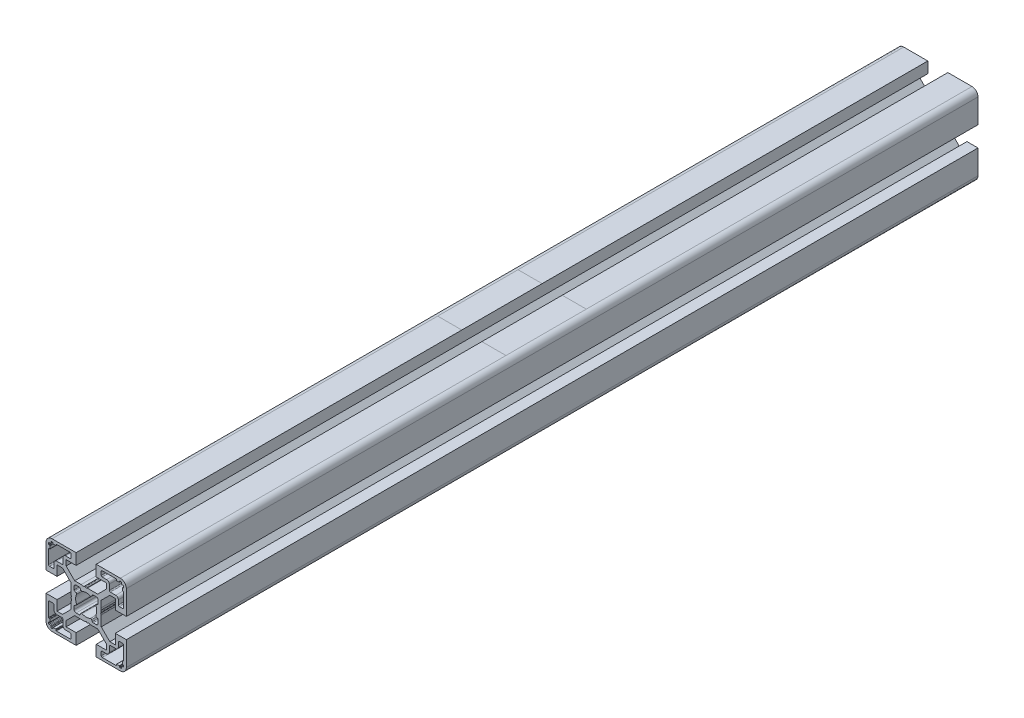
from build123d import *

# Parameters (mm, degrees)
BOSS_EXTRU_1_DEPTH = 424


with BuildPart() as part:
    # Esquisse1 → Boss.-Extru.1 (new body)
    with BuildSketch(Plane.XY.offset(50)):
        with BuildLine():
            Line((-12.564461466, 27.123082583), (-12.564461466, 15.123082583))
            Line((-12.564461466, 15.123082583), (-7.064461466, 15.123082583))
            Line((-7.064461466, 15.123082583), (-7.064461466, 20.123082583))
            Line((-7.064461466, 20.123082583), (-4.332228419, 20.123082583))
            Line((-4.332228419, 20.123082583), (-0.064461466, 15.85531563))
            Line((-0.064461466, 15.85531563), (-0.064461466, 10.776672421))
            ThreePointArc((-0.064461466, 10.776672421), (-0.047424379, 10.647262899), (0.002525832, 10.526672421))
            Line((0.002525832, 10.526672421), (0.235538534, 10.123082583))
            Line((0.235538534, 10.123082583), (0.002525832, 9.719492744))
            ThreePointArc((0.002525832, 9.719492744), (-0.064461466, 9.469492744), (0.002525832, 9.219492744))
            Line((0.002525832, 9.219492744), (0.184561942, 8.904196954))
            Line((0.184561942, 8.904196954), (-0.064461466, 7.623082583))
            Line((-0.064461466, 7.623082583), (-0.064461466, 4.390849536))
            Line((-0.064461466, 4.390849536), (-4.332228419, 0.123082583))
            Line((-4.332228419, 0.123082583), (-7.064461466, 0.123082583))
            Line((-7.064461466, 0.123082583), (-7.064461466, 5.123082583))
            Line((-7.064461466, 5.123082583), (-12.564461466, 5.123082583))
            Line((-12.564461466, 5.123082583), (-12.564461466, -6.876917417))
            ThreePointArc((-12.564461466, -6.876917417), (-11.685781809, -8.998237761), (-9.564461466, -9.876917417))
            Line((-9.564461466, -9.876917417), (2.435538534, -9.876917417))
            Line((2.435538534, -9.876917417), (2.435538534, -4.376917417))
            Line((2.435538534, -4.376917417), (-2.564461466, -4.376917417))
            Line((-2.564461466, -4.376917417), (-2.564461466, -1.64468437))
            Line((-2.564461466, -1.64468437), (1.703305487, 2.623082583))
            Line((1.703305487, 2.623082583), (6.781948696, 2.623082583))
            ThreePointArc((6.781948696, 2.623082583), (6.911358218, 2.640119669), (7.031948696, 2.690069881))
            Line((7.031948696, 2.690069881), (7.435538534, 2.923082583))
            Line((7.435538534, 2.923082583), (7.839128373, 2.690069881))
            ThreePointArc((7.839128373, 2.690069881), (8.089128373, 2.623082583), (8.339128373, 2.690069881))
            Line((8.339128373, 2.690069881), (8.654424163, 2.87210599))
            Line((8.654424163, 2.87210599), (9.935538534, 2.623082583))
            Line((9.935538534, 2.623082583), (13.167771581, 2.623082583))
            Line((13.167771581, 2.623082583), (17.435538534, -1.64468437))
            Line((17.435538534, -1.64468437), (17.435538534, -4.376917417))
            Line((17.435538534, -4.376917417), (12.435538534, -4.376917417))
            Line((12.435538534, -4.376917417), (12.435538534, -9.876917417))
            Line((12.435538534, -9.876917417), (24.435538534, -9.876917417))
            ThreePointArc((24.435538534, -9.876917417), (26.556858878, -8.998237761), (27.435538534, -6.876917417))
            Line((27.435538534, -6.876917417), (27.435538534, 5.123082583))
            Line((27.435538534, 5.123082583), (21.935538534, 5.123082583))
            Line((21.935538534, 5.123082583), (21.935538534, 0.123082583))
            Line((21.935538534, 0.123082583), (19.203305487, 0.123082583))
            Line((19.203305487, 0.123082583), (14.935538534, 4.390849536))
            Line((14.935538534, 4.390849536), (14.935538534, 9.469492744))
            ThreePointArc((14.935538534, 9.469492744), (14.918501447, 9.598902267), (14.868551236, 9.719492744))
            Line((14.868551236, 9.719492744), (14.635538534, 10.123082583))
            Line((14.635538534, 10.123082583), (14.868551236, 10.526672421))
            ThreePointArc((14.868551236, 10.526672421), (14.935538534, 10.776672421), (14.868551236, 11.026672421))
            Line((14.868551236, 11.026672421), (14.686515127, 11.341968211))
            Line((14.686515127, 11.341968211), (14.935538534, 12.623082583))
            Line((14.935538534, 12.623082583), (14.935538534, 15.85531563))
            Line((14.935538534, 15.85531563), (19.203305487, 20.123082583))
            Line((19.203305487, 20.123082583), (21.935538534, 20.123082583))
            Line((21.935538534, 20.123082583), (21.935538534, 15.123082583))
            Line((21.935538534, 15.123082583), (27.435538534, 15.123082583))
            Line((27.435538534, 15.123082583), (27.435538534, 27.123082583))
            ThreePointArc((27.435538534, 27.123082583), (26.556858878, 29.244402926), (24.435538534, 30.123082583))
            Line((24.435538534, 30.123082583), (12.435538534, 30.123082583))
            Line((12.435538534, 30.123082583), (12.435538534, 24.623082583))
            Line((12.435538534, 24.623082583), (17.435538534, 24.623082583))
            Line((17.435538534, 24.623082583), (17.435538534, 21.890849536))
            Line((17.435538534, 21.890849536), (13.167771581, 17.623082583))
            Line((13.167771581, 17.623082583), (8.089128373, 17.623082583))
            ThreePointArc((8.089128373, 17.623082583), (7.95971885, 17.606045496), (7.839128373, 17.556095285))
            Line((7.839128373, 17.556095285), (7.435538534, 17.323082583))
            Line((7.435538534, 17.323082583), (7.031948696, 17.556095285))
            ThreePointArc((7.031948696, 17.556095285), (6.781948696, 17.623082583), (6.531948696, 17.556095285))
            Line((6.531948696, 17.556095285), (6.216652905, 17.374059175))
            Line((6.216652905, 17.374059175), (4.935538534, 17.623082583))
            Line((4.935538534, 17.623082583), (1.703305487, 17.623082583))
            Line((1.703305487, 17.623082583), (-2.564461466, 21.890849536))
            Line((-2.564461466, 21.890849536), (-2.564461466, 24.623082583))
            Line((-2.564461466, 24.623082583), (2.435538534, 24.623082583))
            Line((2.435538534, 24.623082583), (2.435538534, 30.123082583))
            Line((2.435538534, 30.123082583), (-9.564461466, 30.123082583))
            ThreePointArc((-9.564461466, 30.123082583), (-11.685781809, 29.244402926), (-12.564461466, 27.123082583))
        make_face()
        with BuildLine():
            Line((-11.264461466, -4.676917417), (-11.264461466, 2.123082583))
            ThreePointArc((-11.264461466, 2.123082583), (-11.118014856, 2.476635973), (-10.764461466, 2.623082583))
            Line((-10.764461466, 2.623082583), (-9.064461466, 2.623082583))
            ThreePointArc((-9.064461466, 2.623082583), (-8.710908075, 2.476635973), (-8.564461466, 2.123082583))
            Line((-8.564461466, 2.123082583), (-8.564461466, -0.076917417))
            ThreePointArc((-8.564461466, -0.076917417), (-8.183700281, -0.996156233), (-7.264461466, -1.376917417))
            Line((-7.264461466, -1.376917417), (-4.564461466, -1.376917417))
            ThreePointArc((-4.564461466, -1.376917417), (-4.210908075, -1.523364027), (-4.064461466, -1.876917417))
            Line((-4.064461466, -1.876917417), (-4.064461466, -4.576917417))
            ThreePointArc((-4.064461466, -4.576917417), (-3.683700281, -5.496156233), (-2.764461466, -5.876917417))
            Line((-2.764461466, -5.876917417), (-0.564461466, -5.876917417))
            ThreePointArc((-0.564461466, -5.876917417), (-0.210908075, -6.023364027), (-0.064461466, -6.376917417))
            Line((-0.064461466, -6.376917417), (-0.064461466, -8.076917417))
            ThreePointArc((-0.064461466, -8.076917417), (-0.210908075, -8.430470808), (-0.564461466, -8.576917417))
            Line((-0.564461466, -8.576917417), (-7.364461466, -8.576917417))
            ThreePointArc((-7.364461466, -8.576917417), (-7.505882822, -8.518338774), (-7.564461466, -8.376917417))
            Line((-7.564461466, -8.376917417), (-7.564461466, -8.076917417))
            ThreePointArc((-7.564461466, -8.076917417), (-7.62304011, -7.935496061), (-7.764461466, -7.876917417))
            Line((-7.764461466, -7.876917417), (-8.964461466, -7.876917417))
            ThreePointArc((-8.964461466, -7.876917417), (-9.105882822, -7.935496061), (-9.164461466, -8.076917417))
            Line((-9.164461466, -8.076917417), (-9.164461466, -8.376917417))
            ThreePointArc((-9.164461466, -8.376917417), (-9.22304011, -8.518338774), (-9.364461466, -8.576917417))
            Line((-9.364461466, -8.576917417), (-9.864461466, -8.576917417))
            ThreePointArc((-9.864461466, -8.576917417), (-10.0765935, -8.489049452), (-10.164461466, -8.276917417))
            Line((-10.164461466, -8.276917417), (-10.164461466, -7.776917417))
            ThreePointArc((-10.164461466, -7.776917417), (-10.252329431, -7.564785383), (-10.464461466, -7.476917417))
            Line((-10.464461466, -7.476917417), (-10.964461466, -7.476917417))
            ThreePointArc((-10.964461466, -7.476917417), (-11.1765935, -7.389049452), (-11.264461466, -7.176917417))
            Line((-11.264461466, -7.176917417), (-11.264461466, -6.676917417))
            ThreePointArc((-11.264461466, -6.676917417), (-11.205882822, -6.535496061), (-11.064461466, -6.476917417))
            Line((-11.064461466, -6.476917417), (-10.764461466, -6.476917417))
            ThreePointArc((-10.764461466, -6.476917417), (-10.62304011, -6.418338774), (-10.564461466, -6.276917417))
            Line((-10.564461466, -6.276917417), (-10.564461466, -5.076917417))
            ThreePointArc((-10.564461466, -5.076917417), (-10.62304011, -4.935496061), (-10.764461466, -4.876917417))
            Line((-10.764461466, -4.876917417), (-11.064461466, -4.876917417))
            ThreePointArc((-11.064461466, -4.876917417), (-11.205882822, -4.818338774), (-11.264461466, -4.676917417))
        make_face(mode=Mode.SUBTRACT)
        with BuildLine():
            Line((14.935538534, -8.076917417), (14.935538534, -6.376917417))
            ThreePointArc((14.935538534, -6.376917417), (15.081985144, -6.023364027), (15.435538534, -5.876917417))
            Line((15.435538534, -5.876917417), (17.635538534, -5.876917417))
            ThreePointArc((17.635538534, -5.876917417), (18.55477735, -5.496156233), (18.935538534, -4.576917417))
            Line((18.935538534, -4.576917417), (18.935538534, -1.876917417))
            ThreePointArc((18.935538534, -1.876917417), (19.081985144, -1.523364027), (19.435538534, -1.376917417))
            Line((19.435538534, -1.376917417), (22.135538534, -1.376917417))
            ThreePointArc((22.135538534, -1.376917417), (23.05477735, -0.996156233), (23.435538534, -0.076917417))
            Line((23.435538534, -0.076917417), (23.435538534, 2.123082583))
            ThreePointArc((23.435538534, 2.123082583), (23.581985144, 2.476635973), (23.935538534, 2.623082583))
            Line((23.935538534, 2.623082583), (25.635538534, 2.623082583))
            ThreePointArc((25.635538534, 2.623082583), (25.989091925, 2.476635973), (26.135538534, 2.123082583))
            Line((26.135538534, 2.123082583), (26.135538534, -4.676917417))
            ThreePointArc((26.135538534, -4.676917417), (26.07695989, -4.818338774), (25.935538534, -4.876917417))
            Line((25.935538534, -4.876917417), (25.635538534, -4.876917417))
            ThreePointArc((25.635538534, -4.876917417), (25.494117178, -4.935496061), (25.435538534, -5.076917417))
            Line((25.435538534, -5.076917417), (25.435538534, -6.276917417))
            ThreePointArc((25.435538534, -6.276917417), (25.494117178, -6.418338774), (25.635538534, -6.476917417))
            Line((25.635538534, -6.476917417), (25.935538534, -6.476917417))
            ThreePointArc((25.935538534, -6.476917417), (26.07695989, -6.535496061), (26.135538534, -6.676917417))
            Line((26.135538534, -6.676917417), (26.135538534, -7.176917417))
            ThreePointArc((26.135538534, -7.176917417), (26.047670569, -7.389049452), (25.835538534, -7.476917417))
            Line((25.835538534, -7.476917417), (25.335538534, -7.476917417))
            ThreePointArc((25.335538534, -7.476917417), (25.1234065, -7.564785383), (25.035538534, -7.776917417))
            Line((25.035538534, -7.776917417), (25.035538534, -8.276917417))
            ThreePointArc((25.035538534, -8.276917417), (24.947670569, -8.489049452), (24.735538534, -8.576917417))
            Line((24.735538534, -8.576917417), (24.235538534, -8.576917417))
            ThreePointArc((24.235538534, -8.576917417), (24.094117178, -8.518338774), (24.035538534, -8.376917417))
            Line((24.035538534, -8.376917417), (24.035538534, -8.076917417))
            ThreePointArc((24.035538534, -8.076917417), (23.97695989, -7.935496061), (23.835538534, -7.876917417))
            Line((23.835538534, -7.876917417), (22.635538534, -7.876917417))
            ThreePointArc((22.635538534, -7.876917417), (22.494117178, -7.935496061), (22.435538534, -8.076917417))
            Line((22.435538534, -8.076917417), (22.435538534, -8.376917417))
            ThreePointArc((22.435538534, -8.376917417), (22.37695989, -8.518338774), (22.235538534, -8.576917417))
            Line((22.235538534, -8.576917417), (15.435538534, -8.576917417))
            ThreePointArc((15.435538534, -8.576917417), (15.081985144, -8.430470808), (14.935538534, -8.076917417))
        make_face(mode=Mode.SUBTRACT)
        with BuildLine():
            Line((14.935538534, 26.623082583), (14.935538534, 28.323082583))
            ThreePointArc((14.935538534, 28.323082583), (15.081985144, 28.676635973), (15.435538534, 28.823082583))
            Line((15.435538534, 28.823082583), (22.235538534, 28.823082583))
            ThreePointArc((22.235538534, 28.823082583), (22.37695989, 28.764503939), (22.435538534, 28.623082583))
            Line((22.435538534, 28.623082583), (22.435538534, 28.323082583))
            ThreePointArc((22.435538534, 28.323082583), (22.494117178, 28.181661226), (22.635538534, 28.123082583))
            Line((22.635538534, 28.123082583), (23.835538534, 28.123082583))
            ThreePointArc((23.835538534, 28.123082583), (23.97695989, 28.181661226), (24.035538534, 28.323082583))
            Line((24.035538534, 28.323082583), (24.035538534, 28.623082583))
            ThreePointArc((24.035538534, 28.623082583), (24.094117178, 28.764503939), (24.235538534, 28.823082583))
            Line((24.235538534, 28.823082583), (24.735538534, 28.823082583))
            ThreePointArc((24.735538534, 28.823082583), (24.947670569, 28.735214617), (25.035538534, 28.523082583))
            Line((25.035538534, 28.523082583), (25.035538534, 28.023082583))
            ThreePointArc((25.035538534, 28.023082583), (25.1234065, 27.810950548), (25.335538534, 27.723082583))
            Line((25.335538534, 27.723082583), (25.835538534, 27.723082583))
            ThreePointArc((25.835538534, 27.723082583), (26.047670569, 27.635214617), (26.135538534, 27.423082583))
            Line((26.135538534, 27.423082583), (26.135538534, 26.923082583))
            ThreePointArc((26.135538534, 26.923082583), (26.07695989, 26.781661226), (25.935538534, 26.723082583))
            Line((25.935538534, 26.723082583), (25.635538534, 26.723082583))
            ThreePointArc((25.635538534, 26.723082583), (25.494117178, 26.664503939), (25.435538534, 26.523082583))
            Line((25.435538534, 26.523082583), (25.435538534, 25.323082583))
            ThreePointArc((25.435538534, 25.323082583), (25.494117178, 25.181661226), (25.635538534, 25.123082583))
            Line((25.635538534, 25.123082583), (25.935538534, 25.123082583))
            ThreePointArc((25.935538534, 25.123082583), (26.07695989, 25.064503939), (26.135538534, 24.923082583))
            Line((26.135538534, 24.923082583), (26.135538534, 18.123082583))
            ThreePointArc((26.135538534, 18.123082583), (25.989091925, 17.769529192), (25.635538534, 17.623082583))
            Line((25.635538534, 17.623082583), (23.935538534, 17.623082583))
            ThreePointArc((23.935538534, 17.623082583), (23.581985144, 17.769529192), (23.435538534, 18.123082583))
            Line((23.435538534, 18.123082583), (23.435538534, 20.323082583))
            ThreePointArc((23.435538534, 20.323082583), (23.05477735, 21.242321398), (22.135538534, 21.623082583))
            Line((22.135538534, 21.623082583), (19.435538534, 21.623082583))
            ThreePointArc((19.435538534, 21.623082583), (19.081985144, 21.769529192), (18.935538534, 22.123082583))
            Line((18.935538534, 22.123082583), (18.935538534, 24.823082583))
            ThreePointArc((18.935538534, 24.823082583), (18.55477735, 25.742321398), (17.635538534, 26.123082583))
            Line((17.635538534, 26.123082583), (15.435538534, 26.123082583))
            ThreePointArc((15.435538534, 26.123082583), (15.081985144, 26.269529192), (14.935538534, 26.623082583))
        make_face(mode=Mode.SUBTRACT)
        with BuildLine():
            Line((-11.264461466, 18.123082583), (-11.264461466, 24.923082583))
            ThreePointArc((-11.264461466, 24.923082583), (-11.205882822, 25.064503939), (-11.064461466, 25.123082583))
            Line((-11.064461466, 25.123082583), (-10.764461466, 25.123082583))
            ThreePointArc((-10.764461466, 25.123082583), (-10.62304011, 25.181661226), (-10.564461466, 25.323082583))
            Line((-10.564461466, 25.323082583), (-10.564461466, 26.523082583))
            ThreePointArc((-10.564461466, 26.523082583), (-10.62304011, 26.664503939), (-10.764461466, 26.723082583))
            Line((-10.764461466, 26.723082583), (-11.064461466, 26.723082583))
            ThreePointArc((-11.064461466, 26.723082583), (-11.205882822, 26.781661226), (-11.264461466, 26.923082583))
            Line((-11.264461466, 26.923082583), (-11.264461466, 27.423082583))
            ThreePointArc((-11.264461466, 27.423082583), (-11.1765935, 27.635214617), (-10.964461466, 27.723082583))
            Line((-10.964461466, 27.723082583), (-10.464461466, 27.723082583))
            ThreePointArc((-10.464461466, 27.723082583), (-10.252329431, 27.810950548), (-10.164461466, 28.023082583))
            Line((-10.164461466, 28.023082583), (-10.164461466, 28.523082583))
            ThreePointArc((-10.164461466, 28.523082583), (-10.0765935, 28.735214617), (-9.864461466, 28.823082583))
            Line((-9.864461466, 28.823082583), (-9.364461466, 28.823082583))
            ThreePointArc((-9.364461466, 28.823082583), (-9.22304011, 28.764503939), (-9.164461466, 28.623082583))
            Line((-9.164461466, 28.623082583), (-9.164461466, 28.323082583))
            ThreePointArc((-9.164461466, 28.323082583), (-9.105882822, 28.181661226), (-8.964461466, 28.123082583))
            Line((-8.964461466, 28.123082583), (-7.764461466, 28.123082583))
            ThreePointArc((-7.764461466, 28.123082583), (-7.62304011, 28.181661226), (-7.564461466, 28.323082583))
            Line((-7.564461466, 28.323082583), (-7.564461466, 28.623082583))
            ThreePointArc((-7.564461466, 28.623082583), (-7.505882822, 28.764503939), (-7.364461466, 28.823082583))
            Line((-7.364461466, 28.823082583), (-0.564461466, 28.823082583))
            ThreePointArc((-0.564461466, 28.823082583), (-0.210908075, 28.676635973), (-0.064461466, 28.323082583))
            Line((-0.064461466, 28.323082583), (-0.064461466, 26.623082583))
            ThreePointArc((-0.064461466, 26.623082583), (-0.210908075, 26.269529192), (-0.564461466, 26.123082583))
            Line((-0.564461466, 26.123082583), (-2.764461466, 26.123082583))
            ThreePointArc((-2.764461466, 26.123082583), (-3.683700281, 25.742321398), (-4.064461466, 24.823082583))
            Line((-4.064461466, 24.823082583), (-4.064461466, 22.123082583))
            ThreePointArc((-4.064461466, 22.123082583), (-4.210908075, 21.769529192), (-4.564461466, 21.623082583))
            Line((-4.564461466, 21.623082583), (-7.264461466, 21.623082583))
            ThreePointArc((-7.264461466, 21.623082583), (-8.183700281, 21.242321398), (-8.564461466, 20.323082583))
            Line((-8.564461466, 20.323082583), (-8.564461466, 18.123082583))
            ThreePointArc((-8.564461466, 18.123082583), (-8.710908075, 17.769529192), (-9.064461466, 17.623082583))
            Line((-9.064461466, 17.623082583), (-10.764461466, 17.623082583))
            ThreePointArc((-10.764461466, 17.623082583), (-11.118014856, 17.769529192), (-11.264461466, 18.123082583))
        make_face(mode=Mode.SUBTRACT)
        with BuildLine():
            Line((10.926225434, 16.123082583), (12.435538534, 16.123082583))
            ThreePointArc((12.435538534, 16.123082583), (13.142645315, 15.830189364), (13.435538534, 15.123082583))
            Line((13.435538534, 15.123082583), (13.435538534, 13.613769482))
            ThreePointArc((13.435538534, 13.613769482), (13.364122185, 13.356250445), (13.170274316, 13.172295686))
            Line((13.170274316, 13.172295686), (12.493256258, 12.812318799))
            ThreePointArc((12.493256258, 12.812318799), (12.256654607, 12.537701304), (12.267778691, 12.175387401))
            ThreePointArc((12.267778691, 12.175387401), (12.685538534, 10.123082583), (12.267778691, 8.070777764))
            ThreePointArc((12.267778691, 8.070777764), (12.256654607, 7.708463861), (12.493256258, 7.433846366))
            Line((12.493256258, 7.433846366), (13.170274316, 7.07386948))
            ThreePointArc((13.170274316, 7.07386948), (13.364122185, 6.889914721), (13.435538534, 6.632395683))
            Line((13.435538534, 6.632395683), (13.435538534, 5.123082583))
            ThreePointArc((13.435538534, 5.123082583), (13.142645315, 4.415975801), (12.435538534, 4.123082583))
            Line((12.435538534, 4.123082583), (10.926225434, 4.123082583))
            ThreePointArc((10.926225434, 4.123082583), (10.668706396, 4.194498932), (10.484751637, 4.388346801))
            Line((10.484751637, 4.388346801), (10.124774751, 5.065364859))
            ThreePointArc((10.124774751, 5.065364859), (9.850157255, 5.301966509), (9.487843352, 5.290842426))
            ThreePointArc((9.487843352, 5.290842426), (7.435538534, 4.873082583), (5.383233716, 5.290842426))
            ThreePointArc((5.383233716, 5.290842426), (5.020919813, 5.301966509), (4.746302318, 5.065364859))
            Line((4.746302318, 5.065364859), (4.386325431, 4.388346801))
            ThreePointArc((4.386325431, 4.388346801), (4.202370672, 4.194498932), (3.944851635, 4.123082583))
            Line((3.944851635, 4.123082583), (2.435538534, 4.123082583))
            ThreePointArc((2.435538534, 4.123082583), (1.728431753, 4.415975801), (1.435538534, 5.123082583))
            Line((1.435538534, 5.123082583), (1.435538534, 6.632395683))
            ThreePointArc((1.435538534, 6.632395683), (1.506954884, 6.889914721), (1.700802753, 7.07386948))
            Line((1.700802753, 7.07386948), (2.37782081, 7.433846366))
            ThreePointArc((2.37782081, 7.433846366), (2.614422461, 7.708463861), (2.603298377, 8.070777764))
            ThreePointArc((2.603298377, 8.070777764), (2.185538534, 10.123082583), (2.603298377, 12.175387401))
            ThreePointArc((2.603298377, 12.175387401), (2.614422461, 12.537701304), (2.37782081, 12.812318799))
            Line((2.37782081, 12.812318799), (1.700802753, 13.172295686))
            ThreePointArc((1.700802753, 13.172295686), (1.506954884, 13.356250445), (1.435538534, 13.613769482))
            Line((1.435538534, 13.613769482), (1.435538534, 15.123082583))
            ThreePointArc((1.435538534, 15.123082583), (1.728431753, 15.830189364), (2.435538534, 16.123082583))
            Line((2.435538534, 16.123082583), (3.944851635, 16.123082583))
            ThreePointArc((3.944851635, 16.123082583), (4.202370672, 16.051666233), (4.386325431, 15.857818364))
            Line((4.386325431, 15.857818364), (4.746302318, 15.180800306))
            ThreePointArc((4.746302318, 15.180800306), (5.020919813, 14.944198656), (5.383233716, 14.955322739))
            ThreePointArc((5.383233716, 14.955322739), (7.435538534, 15.373082583), (9.487843352, 14.955322739))
            ThreePointArc((9.487843352, 14.955322739), (9.850157255, 14.944198656), (10.124774751, 15.180800306))
            Line((10.124774751, 15.180800306), (10.484751637, 15.857818364))
            ThreePointArc((10.484751637, 15.857818364), (10.668706396, 16.051666233), (10.926225434, 16.123082583))
        make_face(mode=Mode.SUBTRACT)
    extrude(amount=-BOSS_EXTRU_1_DEPTH)


solid = part.part
